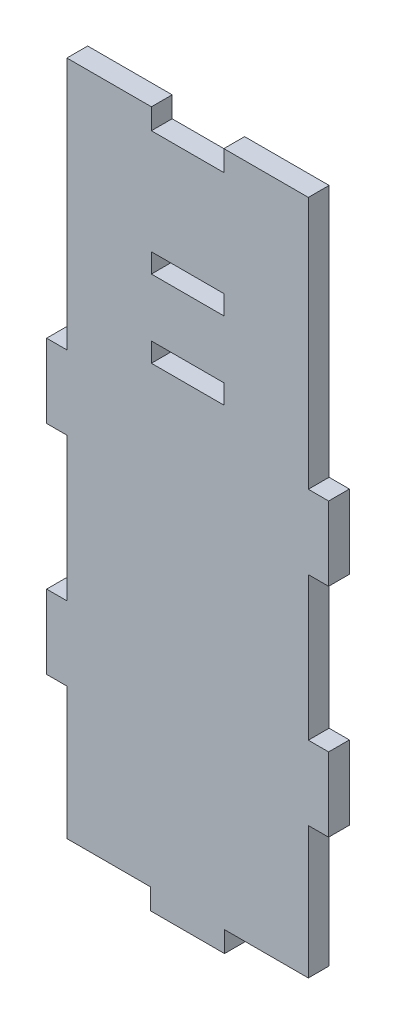
from build123d import *

# Parameters (mm, degrees)
SKETCH1_W           = 15
SKETCH1_H           = 4
BOSS_EXTRUDE1_DEPTH = 4.3


with BuildPart() as part:
    # Sketch1 → Boss-Extrude1 (new body)
    with BuildSketch(Plane.XY):
        Polygon((25, -27.35), (25, 2.35), (29.2, 2.35), (29.2, 17.65), (25, 17.65), (25, 70), (7.5, 70), (7.5, 65.7), (-7.5, 65.7), (-7.5, 70), (-25, 70), (-25, 17.65), (-29.2, 17.65), (-29.2, 2.35), (-25, 2.35), (-25, -27.35), (-29.2, -27.35), (-29.2, -42.65), (-25, -42.65), (-25, -70), (-7.65, -70), (-7.65, -74.3), (7.65, -74.3), (7.65, -70), (25, -70), (25, -42.65), (29.2, -42.65), (29.2, -27.35), align=None)
        with Locations((0, 26)):
            Rectangle(SKETCH1_W, SKETCH1_H, mode=Mode.SUBTRACT)
        with Locations((0, 42)):
            Rectangle(SKETCH1_W, SKETCH1_H, mode=Mode.SUBTRACT)
    extrude(amount=BOSS_EXTRUDE1_DEPTH)


solid = part.part
